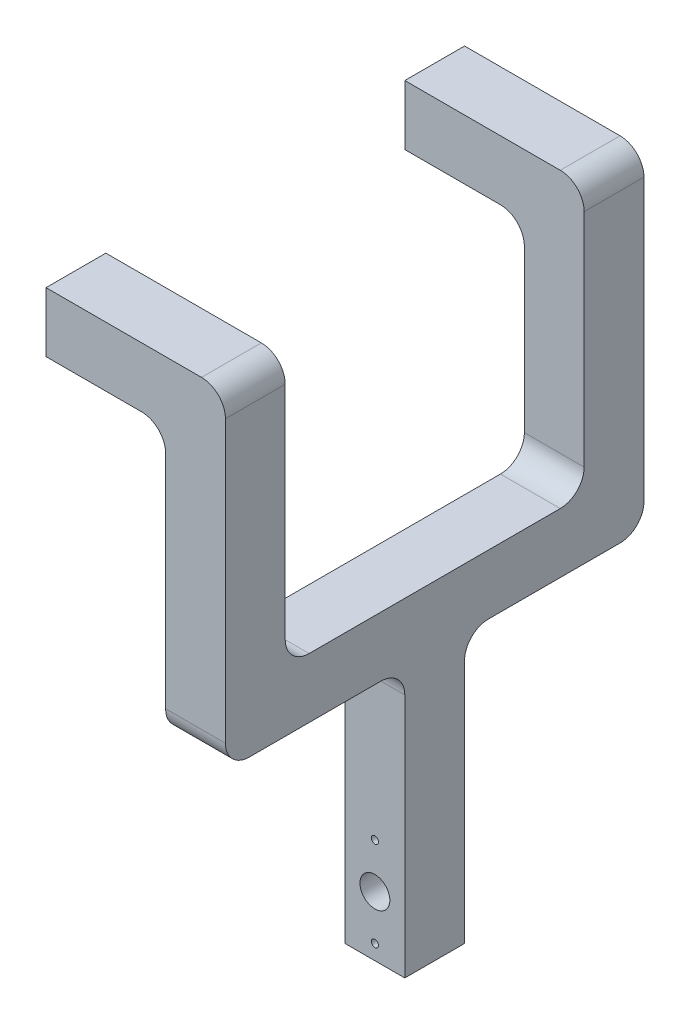
from build123d import *

# Parameters (mm, degrees)
ESQUISSE1_W        = 10
ESQUISSE1_H        = 55
ESQUISSE1_R        = 2.5
ESQUISSE1_R_2      = 0.5
BOSS_EXTRU_1_DEPTH = 10
BOSS_EXTRU_2_DEPTH = 10
ESQUISSE5_W        = 10
ESQUISSE5_H        = 10
BOSS_EXTRU_3_DEPTH = 20
CONG_1_R           = 4
D_GAGEMENT_M11_D   = 1.2


with BuildPart() as part:
    # Esquisse1 → Boss.-Extru.1 (new body)
    with BuildSketch(Plane.XY):
        with Locations((9, 27.5)):
            Rectangle(ESQUISSE1_W, ESQUISSE1_H)
        with Locations((9, 10)):
            Circle(ESQUISSE1_R, mode=Mode.SUBTRACT)
        with Locations((9, 17.5)):
            Circle(ESQUISSE1_R_2, mode=Mode.SUBTRACT)
        with Locations((9, 2.5)):
            Circle(ESQUISSE1_R_2, mode=Mode.SUBTRACT)
    extrude(amount=BOSS_EXTRU_1_DEPTH)

    # Esquisse4 → Boss.-Extru.2 (add)
    with BuildSketch(Plane(origin=(14, 0, 0), x_dir=(0, 0, -1), z_dir=(1, 0, 0))):
        Polygon((-30, 55), (20, 55), (20, 100), (30, 100), (30, 45), (-40, 45), (-40, 100), (-30, 100), align=None)
    extrude(amount=-BOSS_EXTRU_2_DEPTH)

    # Esquisse5 → Boss.-Extru.3 (add)
    with BuildSketch(Plane.ZY.offset(-4)):
        with Locations((-25, 95)):
            Rectangle(ESQUISSE5_W, ESQUISSE5_H)
        with Locations((35, 95)):
            Rectangle(ESQUISSE5_W, ESQUISSE5_H)
    extrude(amount=BOSS_EXTRU_3_DEPTH)

    # Congé1
    cong_1_edges = [part.edges().sort_by_distance(p)[0] for p in [
        (9, 45, 0),
        (9, 45, -30),
        (14, 100, -25),
        (9, 55, -20),
        (9, 45, 10),
        (9, 45, 40),
        (9, 55, 30),
        (14, 100, 35),
        (4, 90, -25),
        (4, 90, 35),
    ]]
    fillet(cong_1_edges, radius=CONG_1_R)

    # Dégagement M11 (through all)
    with Locations(Plane.XY.offset(10)):
        with Locations((9, 17.5), (9, 2.5)):
            Hole(D_GAGEMENT_M11_D / 2)


solid = part.part
